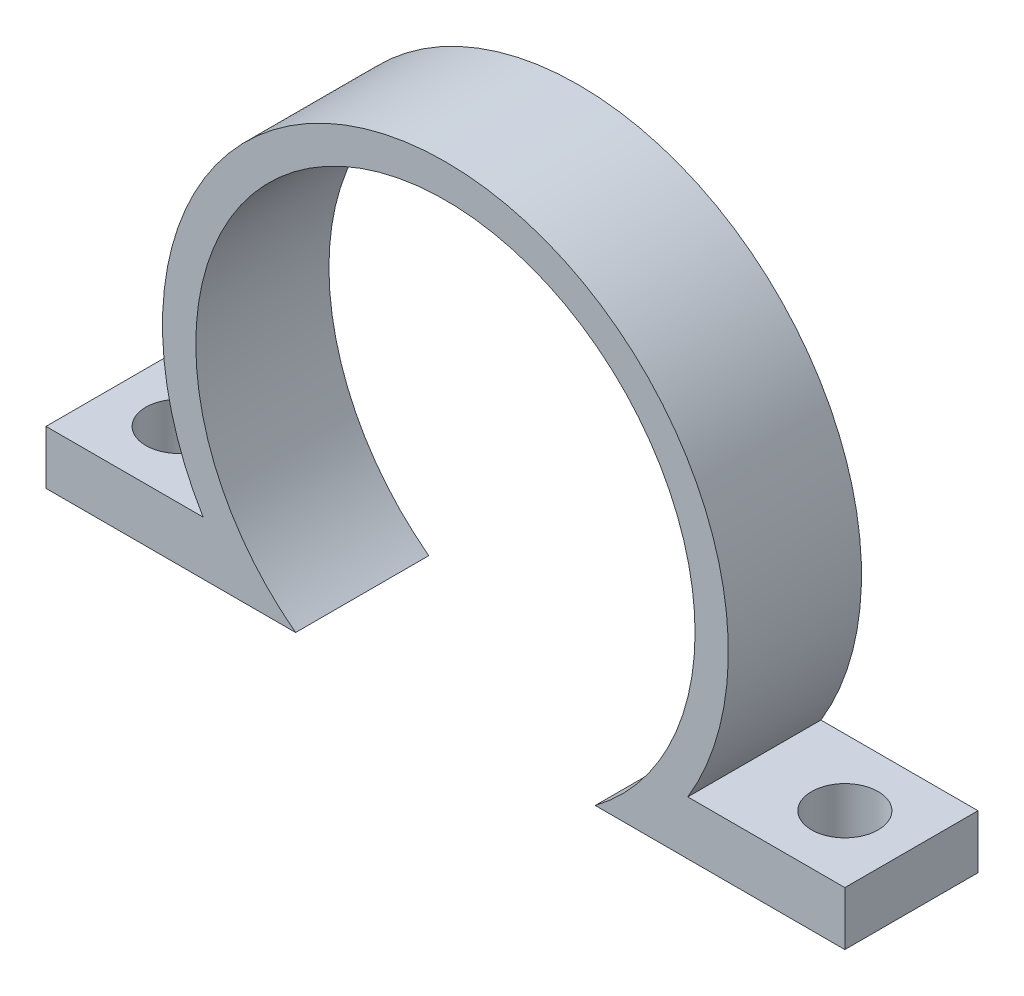
from build123d import *

# Parameters (mm, degrees)
SKETCH1_W           = 38.1
SKETCH1_H           = 10.16
SKETCH1_W_2         = 12.7
SKETCH1_R           = 2.54
BOSS_EXTRUDE1_DEPTH = 50.8
SKETCH2_W           = 63.5
SKETCH2_H           = 50.8
CUT_EXTRUDE1_DEPTH  = 61.761238467


with BuildPart() as part:
    # Sketch1 → Boss-Extrude1 (new body)
    # profile 1 of 3: a face of its own
    with BuildSketch(Plane(origin=(0, 0, 0), x_dir=(1, 0, 0), z_dir=(0, 1, 0))):
        with Locations((0, -1.905)):
            Rectangle(SKETCH1_W, SKETCH1_H)
    # profile 2 of 3: a face of its own
    with BuildSketch(Plane(origin=(0, 0, 0), x_dir=(1, 0, 0), z_dir=(0, 1, 0))):
        with Locations((-25.4, -1.905)):
            Rectangle(SKETCH1_W_2, SKETCH1_H)
        with Locations(Location((-25.4, -1.905, 0), (0, 0, 270))):
            Circle(SKETCH1_R, mode=Mode.SUBTRACT)
    # profile 3 of 3: a face of its own
    with BuildSketch(Plane(origin=(0, 0, 0), x_dir=(1, 0, 0), z_dir=(0, 1, 0))):
        with Locations((25.4, -1.905)):
            Rectangle(SKETCH1_W_2, SKETCH1_H)
        with Locations(Location((25.4, -1.905, 0), (0, 0, 270))):
            Circle(SKETCH1_R, mode=Mode.SUBTRACT)
    extrude(amount=BOSS_EXTRUDE1_DEPTH)

    # Sketch2 → Cut-Extrude1 (cut, through all)
    # profile 1 of 2: a face of its own
    with BuildSketch(Plane.XY.offset(6.985)):
        with Locations((0, 25.4)):
            Rectangle(SKETCH2_W, SKETCH2_H)
        with BuildLine():
            Line((-11.43, 10.16), (-30.48, 10.16))
            Line((-30.48, 10.16), (-30.48, 14.258420741))
            Line((-30.48, 14.258420741), (-18.493061175, 14.258420741))
            ThreePointArc((-18.493061175, 14.258420741), (0, 46.99), (18.493061175, 14.258420741))
            Line((18.493061175, 14.258420741), (30.48, 14.258420741))
            Line((30.48, 14.258420741), (30.48, 10.16))
            Line((30.48, 10.16), (11.43, 10.16))
            ThreePointArc((11.43, 10.16), (0, 44.45), (-11.43, 10.16))
        make_face(mode=Mode.SUBTRACT)
    # profile 2 of 2: a face of its own
    with BuildSketch(Plane.XY.offset(6.985)):
        with Locations((0, 25.4)):
            Rectangle(SKETCH2_W, SKETCH2_H)
        with BuildLine():
            Line((-11.43, 10.16), (-30.48, 10.16))
            Line((-30.48, 10.16), (-30.48, 14.258420741))
            Line((-30.48, 14.258420741), (-18.493061175, 14.258420741))
            ThreePointArc((-18.493061175, 14.258420741), (0, 46.99), (18.493061175, 14.258420741))
            Line((18.493061175, 14.258420741), (30.48, 14.258420741))
            Line((30.48, 14.258420741), (30.48, 10.16))
            Line((30.48, 10.16), (11.43, 10.16))
            ThreePointArc((11.43, 10.16), (0, 44.45), (-11.43, 10.16))
        make_face(mode=Mode.SUBTRACT)
    extrude(amount=-CUT_EXTRUDE1_DEPTH, mode=Mode.SUBTRACT)


solid = part.part
